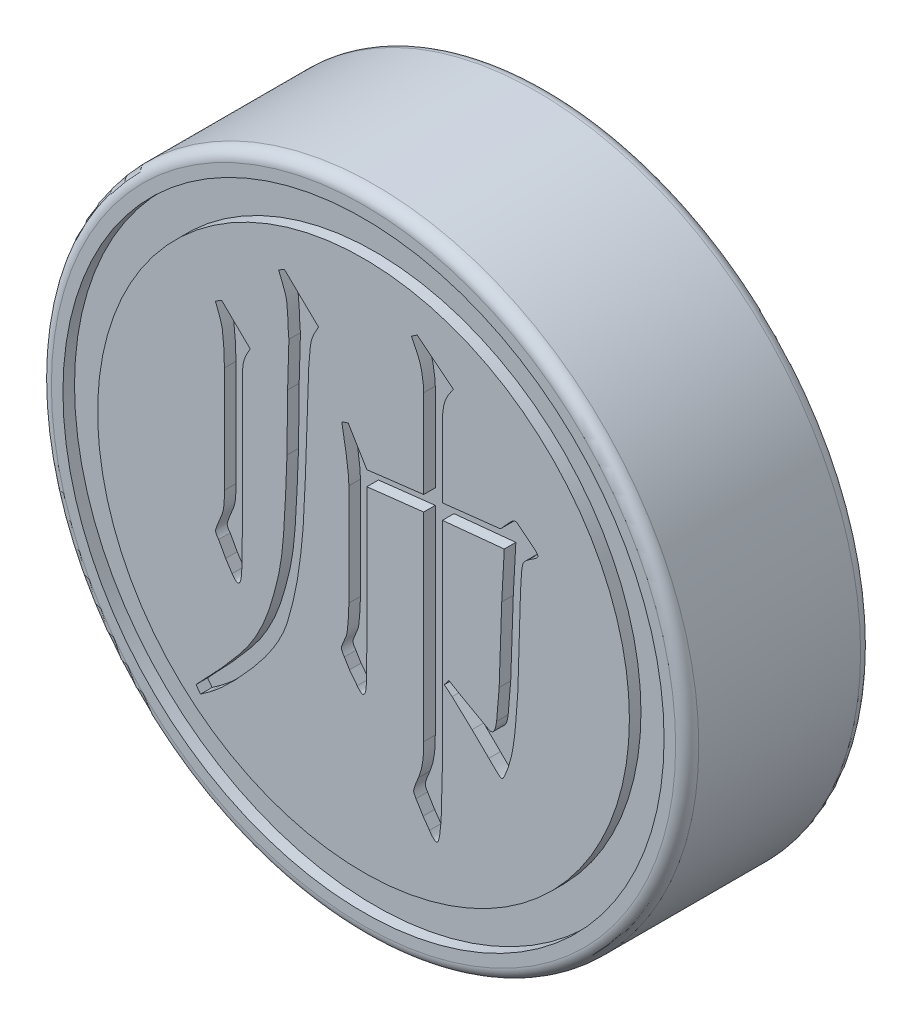
from build123d import *

# Parameters (mm, degrees)
SKETCH_1_R          = 14
EXTRUDE_1_DEPTH     = 8
SKETCH_2_R          = 13
SKETCH_2_R_2        = 11.5
CUT_EXTRUDE_1_DEPTH = 0.5
SKETCH_3_R          = 5.1
CUT_EXTRUDE_2_DEPTH = 5
CHAMFER_1_SIZE      = 0.5
FILLET_1_R          = 0.5
CUT_EXTRUDE_3_DEPTH = 0.5


with BuildPart() as part:
    # 草图1 → 凸台-拉伸1 (new body)
    with BuildSketch(Plane.XY):
        Circle(SKETCH_1_R)
    extrude(amount=EXTRUDE_1_DEPTH)

    # 草图2 → 切除-拉伸1 (cut)
    with BuildSketch(Plane.XY.offset(8)):
        Circle(SKETCH_2_R)
        Circle(SKETCH_2_R_2, mode=Mode.SUBTRACT)
    extrude(amount=-CUT_EXTRUDE_1_DEPTH, mode=Mode.SUBTRACT)

    # 草图3 → 切除-拉伸2 (cut)
    with BuildSketch(Plane(origin=(0, 0, 0), x_dir=(-1, 0, 0), z_dir=(0, 0, -1))):
        Circle(SKETCH_3_R)
    extrude(amount=-CUT_EXTRUDE_2_DEPTH, mode=Mode.SUBTRACT)

    # 倒角1
    chamfer_1_edges = [part.edges().sort_by_distance(p)[0] for p in [
        (5.1, 0, 0),
    ]]
    chamfer(chamfer_1_edges, length=CHAMFER_1_SIZE)

    # 圆角1
    fillet_1_edges = [part.edges().sort_by_distance(p)[0] for p in [
        (-14, 0, 0),
        (-14, 0, 8),
    ]]
    fillet(fillet_1_edges, radius=FILLET_1_R)

    # 草图4 → 切除-拉伸3 (cut)
    with BuildSketch(Plane.XY.offset(8)):
        with BuildLine():
            add(Edge.make_bspline(
                [(3.885991103, 8.535881557), (3.8426112, 8.478348686), (3.759265042, 8.367810319), (3.653563712, 8.19825516), (3.569541138, 8.034476191), (3.505178571, 7.871611753), (3.46386298, 7.697991042), (3.434376294, 7.507172522), (3.414126098, 7.291613899), (3.412936708, 7.139811147), (3.412306892, 7.059427263)],
                knots=[0, 0, 0, 0, 1.088676442, 2.091682825, 3.015434333, 3.868136819, 4.731282801, 5.706423812, 6.785486037, 8, 8, 8, 8], degree=3))
            Line((3.412306892, 7.059427263), (3.412306892, 4.048346931))
            Line((3.412306892, 4.048346931), (5.922002183, 4.330895407))
            Line((5.922002183, 4.330895407), (6.367985563, 4.81565995))
            add(Edge.make_bspline(
                [(6.367985563, 4.81565995), (6.394421845, 4.842009866), (6.441362803, 4.888797467), (6.522455698, 4.934731776), (6.608528391, 4.936417135), (6.652496807, 4.906224209), (6.675464787, 4.890452194)],
                knots=[0, 0, 0, 0, 1.259354084, 2.236142162, 3.078605628, 4, 4, 4, 4], degree=3))
            Line((6.675464787, 4.890452194), (7.40122656, 4.311504825))
            add(Edge.make_bspline(
                [(7.40122656, 4.311504825), (7.438355048, 4.276740607), (7.496943673, 4.221882791), (7.553517415, 4.120116594), (7.509882546, 4.029707734), (7.459154257, 3.994520994), (7.428927391, 3.973554687)],
                knots=[0, 0, 0, 0, 1.444139648, 2.278847368, 2.974437134, 4, 4, 4, 4], degree=3))
            Line((7.428927391, 3.973554687), (7.20455066, 3.823970199))
            add(Edge.make_bspline(
                [(7.20455066, 3.823970199), (7.161674353, 3.793219866), (7.077955218, 3.733177583), (6.978981839, 3.648860712), (6.915885243, 3.560035987), (6.881525999, 3.469868733), (6.858238576, 3.355717466), (6.839030919, 3.21687525), (6.827058201, 3.048391316), (6.812639623, 2.84806788), (6.799380925, 2.613482358), (6.785521305, 2.354057263), (6.775293917, 2.089927053), (6.766705675, 1.838777281), (6.760961022, 1.609773661), (6.759337743, 1.463861903), (6.75856728, 1.394607318)],
                knots=[0, 0, 0, 0, 0.863367217, 1.685787865, 2.108674281, 2.629999972, 3.248831972, 4.010865052, 4.919611888, 6.008958495, 7.294120596, 8.760130291, 10.255602345, 11.614768517, 12.867889625, 14, 14, 14, 14], degree=3))
            Line((6.75856728, 1.394607318), (6.675464787, -1.372705701))
            add(Edge.make_bspline(
                [(6.675464787, -1.372705701), (6.667075737, -1.479809667), (6.650950164, -1.685686712), (6.629133777, -1.980264323), (6.609335681, -2.247090334), (6.587343057, -2.575163709), (6.553065839, -2.995490866), (6.48247753, -3.516320499), (6.387847222, -4.040506444), (6.262953472, -4.444273881), (6.15834936, -4.713268951), (6.091420237, -4.858581098), (6.040475413, -4.947643434), (5.974542967, -5.009318742), (5.885555055, -4.949005696), (5.778734765, -4.86393558), (5.612360558, -4.709123556), (5.490737648, -4.585343898), (5.420617142, -4.513979939)],
                knots=[0, 0, 0, 0, 1.15286086, 2.216048534, 3.16980697, 4.024024601, 5.744657196, 7.693948629, 9.662486355, 11.455327261, 12.211574227, 12.770075655, 13.14933343, 13.355519647, 13.613145254, 14.128491735, 14.921000102, 16, 16, 16, 16], degree=3))
            Line((5.420617142, -4.513979939), (4.694855369, -3.804838665))
            Line((4.694855369, -3.804838665), (3.830589441, -2.998744482))
            Line((3.830589441, -2.998744482), (3.495409385, -2.718966089))
            Line((3.495409385, -2.718966089), (3.689315202, -2.458578277))
            Line((3.689315202, -2.458578277), (4.193470327, -2.757747252))
            Line((4.193470327, -2.757747252), (5.002334593, -3.206500715))
            add(Edge.make_bspline(
                [(5.002334593, -3.206500715), (5.068327618, -3.248250858), (5.182633444, -3.320565843), (5.333675704, -3.399727101), (5.431331031, -3.458913103), (5.485932559, -3.464928833), (5.503719635, -3.466888526)],
                knots=[0, 0, 0, 0, 1.644825563, 2.848985109, 3.625043651, 4, 4, 4, 4], degree=3))
            add(Edge.make_bspline(
                [(5.503719635, -3.466888526), (5.535412793, -3.459989399), (5.607942953, -3.444200666), (5.676405415, -3.326079601), (5.726531214, -3.166475691), (5.745069699, -3.037415498), (5.755797197, -2.962733402)],
                knots=[0, 0, 0, 0, 0.621478033, 1.422259655, 2.508362261, 4, 4, 4, 4], degree=3))
            Line((5.755797197, -2.962733402), (5.866600521, -1.635863596))
            Line((5.866600521, -1.635863596), (5.977403845, 1.61898405))
            Line((5.977403845, 1.61898405), (6.088207169, 3.657765213))
            Line((6.088207169, 3.657765213), (3.412306892, 3.394607318))
            Line((3.412306892, 3.394607318), (3.412306892, -5.785448083))
            Line((3.412306892, -5.785448083), (3.35690523, -7.89902149))
            add(Edge.make_bspline(
                [(3.35690523, -7.89902149), (3.347617301, -8.010626185), (3.331226613, -8.207578365), (3.299313636, -8.465501804), (3.256475704, -8.638281588), (3.222743367, -8.757492801), (3.135022875, -8.799012634), (3.048360263, -8.739804962), (2.95301893, -8.643836282), (2.890036168, -8.55182846), (2.852750106, -8.497359441)],
                knots=[0, 0, 0, 0, 1.978004369, 3.490644146, 4.544955441, 5.178413089, 5.550367658, 6.052942907, 6.847333959, 8, 8, 8, 8], degree=3))
            Line((2.852750106, -8.497359441), (2.575741795, -8.10400764))
            Line((2.575741795, -8.10400764), (2.268262571, -7.599852515))
            add(Edge.make_bspline(
                [(2.268262571, -7.599852515), (2.244805727, -7.559267671), (2.202711456, -7.486436498), (2.164040828, -7.378986618), (2.181279917, -7.270884931), (2.219874079, -7.143731936), (2.287855047, -6.966392427), (2.346097878, -6.83316172), (2.379065895, -6.757747252)],
                knots=[0, 0, 0, 0, 0.941559544, 1.689667356, 2.20956064, 3.092072836, 4.353984721, 6, 6, 6, 6], degree=3))
            add(Edge.make_bspline(
                [(2.379065895, -6.757747252), (2.407092938, -6.681519539), (2.468674994, -6.514029185), (2.526554155, -6.283162706), (2.565549153, -6.057740651), (2.591425492, -5.841536875), (2.598743029, -5.584190474), (2.601805028, -5.399472966), (2.603442626, -5.30068354)],
                knots=[0, 0, 0, 0, 0.984629645, 2.163464697, 2.879682009, 3.759007576, 4.801486885, 6, 6, 6, 6], degree=3))
            Line((2.603442626, -5.30068354), (2.603442626, 3.300424493))
            Line((2.603442626, 3.300424493), (0.146378914, 3.0206461))
            Line((0.146378914, 3.0206461), (0.146378914, -2.849159995))
            Line((0.146378914, -2.849159995), (0.118678083, -4.439187695))
            add(Edge.make_bspline(
                [(0.118678083, -4.439187695), (0.115062938, -4.503739912), (0.108146945, -4.627232219), (0.06283097, -4.762821415), (-0.010051021, -4.854813964), (-0.10032457, -4.828876678), (-0.184390738, -4.757140357), (-0.23914494, -4.686460589), (-0.271903634, -4.644173845)],
                knots=[0, 0, 0, 0, 1.492315455, 2.854890041, 3.387633758, 3.932408687, 4.762988234, 6, 6, 6, 6], degree=3))
            Line((-0.271903634, -4.644173845), (-0.604313606, -4.214810964))
            Line((-0.604313606, -4.214810964), (-0.828690338, -3.840849745))
            add(Edge.make_bspline(
                [(-0.828690338, -3.840849745), (-0.850060692, -3.811929101), (-0.888658619, -3.759694267), (-0.927110963, -3.680270574), (-0.953037989, -3.613724605), (-0.956566526, -3.525470155), (-0.910583333, -3.402876582), (-0.843305829, -3.239837038), (-0.763653296, -3.072987284), (-0.720137082, -2.931273779), (-0.702088077, -2.814327818), (-0.688587486, -2.700675571), (-0.67501948, -2.556563665), (-0.657644682, -2.331310029), (-0.638296333, -2.051661909), (-0.633999885, -1.829801202), (-0.632014437, -1.727276338)],
                knots=[0, 0, 0, 0, 0.686977759, 1.240780428, 1.688320567, 2.042574102, 2.90525053, 4.150395755, 5.441929062, 6.438271423, 6.976309328, 7.706996562, 8.631149341, 9.749160238, 12.035628862, 14, 14, 14, 14], degree=3))
            Line((-0.632014437, -1.727276338), (-0.632014437, 2.666075462))
            add(Edge.make_bspline(
                [(-0.632014437, 2.666075462), (-0.633506795, 2.719645314), (-0.63682944, 2.838915412), (-0.65097371, 3.034884339), (-0.677182504, 3.264646384), (-0.710480747, 3.527817546), (-0.751948942, 3.82532205), (-0.804677602, 4.156846242), (-0.869177633, 4.522221967), (-0.915377084, 4.776898872), (-0.939493662, 4.909842775)],
                knots=[0, 0, 0, 0, 0.567359235, 1.263191688, 2.079376439, 3.015499779, 4.071786771, 5.259550277, 6.569457698, 8, 8, 8, 8], degree=3))
            Line((-0.939493662, 4.909842775), (-0.662485352, 5.004025601))
            Line((-0.662485352, 5.004025601), (0.146378914, 3.657765213))
            Line((0.146378914, 3.657765213), (2.603442626, 3.956934188))
            Line((2.603442626, 3.956934188), (2.603442626, 7.77133862))
            add(Edge.make_bspline(
                [(2.603442626, 7.77133862), (2.601027429, 7.847159764), (2.595766062, 8.012331679), (2.559001063, 8.268828887), (2.517908709, 8.533547135), (2.461786824, 8.755596716), (2.393743119, 8.945759061), (2.315637323, 9.132256682), (2.202151754, 9.361102558), (2.117819335, 9.529458272), (2.071586671, 9.621754133)],
                knots=[0, 0, 0, 0, 0.934464522, 2.035676162, 3.190243993, 4.236556035, 4.852152056, 5.678688019, 6.727411848, 8, 8, 8, 8], degree=3))
            Line((2.071586671, 9.621754133), (2.323664233, 9.790729202))
            Line((2.323664233, 9.790729202), (3.885991103, 8.535881557))
        make_face()
        with BuildLine():
            Line((-7.244202803, -8.084617058), (-6.96442441, -7.785448083))
            add(Edge.make_bspline(
                [(-6.96442441, -7.785448083), (-6.82427789, -7.64209288), (-6.540229503, -7.351541144), (-6.121437819, -6.896443494), (-5.704989785, -6.416313732), (-5.284076621, -5.919806484), (-4.886757726, -5.390473643), (-4.550578648, -4.812089552), (-4.259075094, -4.200680921), (-4.031334733, -3.560298047), (-3.849928914, -2.926043215), (-3.697399371, -2.328093677), (-3.587780055, -1.776029467), (-3.497299956, -1.099584131), (-3.434349444, -0.278426631), (-3.38981715, 0.534750896), (-3.360694347, 1.175737719), (-3.341208221, 1.632798588), (-3.324493916, 2.064009395), (-3.315184851, 2.342894985), (-3.310684798, 2.477709812)],
                knots=[0, 0, 0, 0, 0.958119443, 1.941912538, 2.955281433, 3.995507227, 5.052918179, 6.113271855, 7.187157947, 8.285829736, 9.356964842, 10.339519919, 11.234422577, 12.045139313, 13.599766736, 15.168883149, 15.937564725, 16.666372676, 17.355317225, 18, 18, 18, 18], degree=3))
            Line((-3.310684798, 2.477709812), (-3.282983967, 4.929233357))
            add(Edge.make_bspline(
                [(-3.282983967, 4.929233357), (-3.278305003, 5.056654721), (-3.269456192, 5.297632828), (-3.257858115, 5.639264837), (-3.250811229, 5.940345278), (-3.241129246, 6.200665912), (-3.236773624, 6.420487614), (-3.230392694, 6.600489685), (-3.227164467, 6.740855776), (-3.22746002, 6.821199274), (-3.227582304, 6.854441113)],
                knots=[0, 0, 0, 0, 1.588821485, 3.004764526, 4.259355249, 5.341436975, 6.250674531, 6.998895693, 7.585796614, 8, 8, 8, 8], degree=3))
            add(Edge.make_bspline(
                [(-3.227582304, 6.854441113), (-3.232521355, 6.894112555), (-3.243524528, 6.982492235), (-3.25391644, 7.131327352), (-3.261204098, 7.309640929), (-3.272035264, 7.575618834), (-3.282779792, 7.891201503), (-3.312501948, 8.195052396), (-3.36053053, 8.435764173), (-3.439101715, 8.654555704), (-3.539206078, 8.926834069), (-3.626076693, 9.121813953), (-3.673565684, 9.228402332)],
                knots=[0, 0, 0, 0, 0.491350811, 1.094626897, 1.833180992, 2.685133342, 4.366853859, 5.714291297, 6.433312113, 7.377298588, 8.566264965, 10, 10, 10, 10], degree=3))
            Line((-3.673565684, 9.228402332), (-3.424258205, 9.37798682))
            Line((-3.424258205, 9.37798682), (-1.945033828, 7.956934188))
            add(Edge.make_bspline(
                [(-1.945033828, 7.956934188), (-1.987776025, 7.88461495), (-2.067103138, 7.750394512), (-2.159422077, 7.556594312), (-2.230545102, 7.3935258), (-2.277818082, 7.208236362), (-2.306524717, 6.986964101), (-2.338568138, 6.708123688), (-2.364716013, 6.386687636), (-2.373172956, 6.111123417), (-2.384139438, 5.874805819), (-2.388329958, 5.67805198), (-2.397259994, 5.418607404), (-2.408357313, 5.095431219), (-2.421909393, 4.710378666), (-2.439655085, 4.261697249), (-2.454893187, 3.750998997), (-2.474498581, 3.196097695), (-2.492422306, 2.636489711), (-2.512025417, 2.110178895), (-2.530778504, 1.637384815), (-2.551363516, 1.217349023), (-2.566873661, 0.850680963), (-2.583280628, 0.535783469), (-2.600496034, 0.274565037), (-2.618216613, -0.00918205), (-2.64936323, -0.340583469), (-2.688825361, -0.749197267), (-2.747212716, -1.186344047), (-2.807849209, -1.652586966), (-2.887882948, -2.14167767), (-2.989457645, -2.648494868), (-3.120049699, -3.17044322), (-3.240183671, -3.617420372), (-3.358238826, -3.985096712), (-3.475839319, -4.268033346), (-3.618916975, -4.55621516), (-3.781535594, -4.853148764), (-3.971571793, -5.155528509), (-4.184810287, -5.464592613), (-4.420216732, -5.781534624), (-4.678560395, -6.09660932), (-4.941525051, -6.40798411), (-5.207112261, -6.700534352), (-5.459220684, -6.980145944), (-5.713795752, -7.232757828), (-5.954978506, -7.472936835), (-6.195666411, -7.688389475), (-6.425776842, -7.889381321), (-6.583354562, -8.0096941), (-6.659715268, -8.06799656)],
                knots=[0, 0, 0, 0, 0.694601625, 1.289141555, 1.775762276, 2.163068661, 2.86647971, 3.619892346, 4.485935749, 5.533606365, 5.900640111, 6.443288702, 7.161805645, 8.048561636, 9.118830589, 10.349709534, 11.763835549, 13.346200362, 14.943836344, 16.396403561, 17.703921874, 18.858786813, 19.875927943, 20.740453598, 21.467690922, 22.041955883, 23.092630658, 24.221528771, 25.438266477, 26.7413131, 28.111606686, 29.538000108, 31.016672556, 32.56252244, 33.3670377, 34.209785631, 35.094729662, 36.028237563, 37.009750117, 38.0481313, 39.13453043, 40.275207238, 41.418771484, 42.506244608, 43.544372812, 44.532995722, 45.473045892, 46.360065133, 47.205302723, 48, 48, 48, 48], degree=3))
            Line((-6.659715268, -8.06799656), (-7.050296986, -8.347774953))
            Line((-7.050296986, -8.347774953), (-7.244202803, -8.084617058))
        make_face()
        with BuildLine():
            Line((-6.407637706, 6.704856626), (-6.127859313, 6.854441113))
            Line((-6.127859313, 6.854441113), (-4.900712498, 5.657765213))
            add(Edge.make_bspline(
                [(-4.900712498, 5.657765213), (-4.935479686, 5.599018847), (-5.000323984, 5.48945097), (-5.082299801, 5.33095848), (-5.14046458, 5.189721953), (-5.197084394, 5.016970496), (-5.229821929, 4.774340155), (-5.23370855, 4.573786271), (-5.235892554, 4.461089313)],
                knots=[0, 0, 0, 0, 0.971643859, 1.812213463, 2.53713605, 3.144019966, 4.395143208, 6, 6, 6, 6], degree=3))
            Line((-5.235892554, 4.461089313), (-5.235892554, -1.018135064))
            Line((-5.235892554, -1.018135064), (-5.263593385, -2.757747252))
            add(Edge.make_bspline(
                [(-5.263593385, -2.757747252), (-5.267605317, -2.831540407), (-5.274795815, -2.963798247), (-5.291973288, -3.139257142), (-5.327901163, -3.263520944), (-5.368811028, -3.351480947), (-5.445283102, -3.382664515), (-5.524459318, -3.344662763), (-5.602824726, -3.263984898), (-5.652706312, -3.191005606), (-5.681875933, -3.14832897)],
                knots=[0, 0, 0, 0, 1.752439859, 3.14085924, 4.143932392, 4.841490588, 5.332796789, 5.913706861, 6.779983061, 8, 8, 8, 8], degree=3))
            Line((-5.681875933, -3.14832897), (-5.961654327, -2.718966089))
            Line((-5.961654327, -2.718966089), (-6.269133551, -2.159409302))
            add(Edge.make_bspline(
                [(-6.269133551, -2.159409302), (-6.290622397, -2.133395207), (-6.330065855, -2.08564551), (-6.368072172, -2.009178821), (-6.393603842, -1.94248449), (-6.396619388, -1.875960185), (-6.377901976, -1.804041612), (-6.351150636, -1.714120149), (-6.308100609, -1.602696756), (-6.236316631, -1.432939353), (-6.149114176, -1.229183423), (-6.077191846, -1.0248157), (-6.042381582, -0.851179379), (-6.028969839, -0.676704999), (-6.017203493, -0.453204022), (-6.017108311, -0.286861002), (-6.017055989, -0.195420382)],
                knots=[0, 0, 0, 0, 0.685665796, 1.258561298, 1.735096001, 2.13111469, 2.592901774, 3.242426179, 4.047129847, 5.026637627, 7.003054178, 8.569673339, 9.4341111, 10.607441732, 12.135072748, 14, 14, 14, 14], degree=3))
            Line((-6.017055989, -0.195420382), (-6.017055989, 4.386297069))
            add(Edge.make_bspline(
                [(-6.017055989, 4.386297069), (-6.017542366, 4.520219709), (-6.018492374, 4.781801605), (-6.042151204, 5.155851916), (-6.071018361, 5.482329062), (-6.08973808, 5.731479677), (-6.133207214, 5.934036527), (-6.198179313, 6.137253095), (-6.28812548, 6.402308816), (-6.365103718, 6.597180906), (-6.407637706, 6.704856626)],
                knots=[0, 0, 0, 0, 1.354560393, 2.645769792, 3.789182315, 4.672182191, 5.168658224, 5.880837323, 6.829065946, 8, 8, 8, 8], degree=3))
        make_face()
    extrude(amount=-CUT_EXTRUDE_3_DEPTH, mode=Mode.SUBTRACT)


solid = part.part
